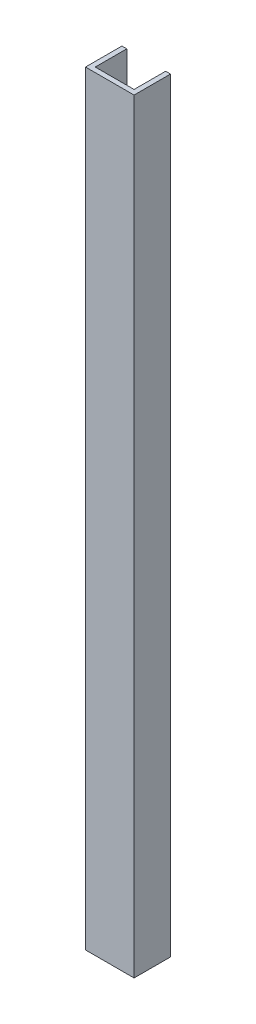
from build123d import *

# Parameters (mm, degrees)
EXTRUDE_1_DEPTH = 315


with BuildPart() as part:
    # Эскиз1 → Бобышка-Вытянуть1 (new body)
    with BuildSketch(Plane(origin=(0, 0, 0), x_dir=(1, 0, 0), z_dir=(0, 1, 0))):
        Polygon((-8, 0), (8, 0), (8, 13), (10, 13), (10, -2), (-10, -2), (-10, 13), (-8, 13), align=None)
    extrude(amount=EXTRUDE_1_DEPTH)


solid = part.part
